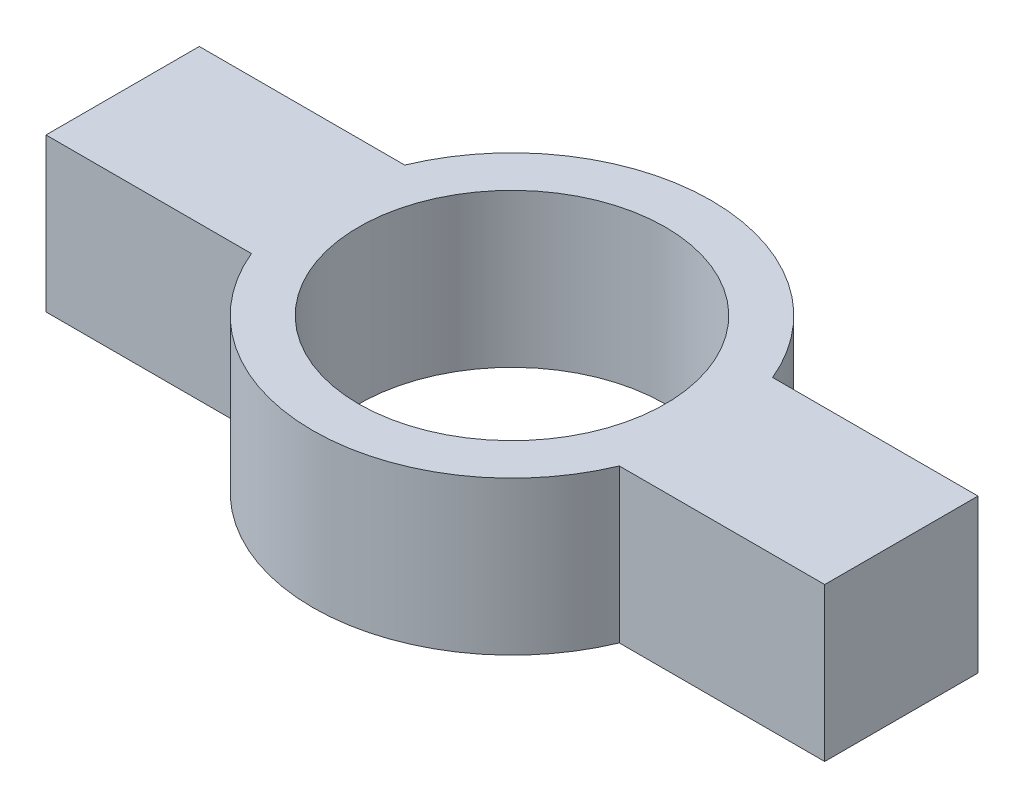
from build123d import *

# Parameters (mm, degrees)
SKETCH1_R           = 6.5
SKETCH1_R_2         = 5
BOSS_EXTRUDE1_DEPTH = 5
SKETCH2_W           = 5
SKETCH2_H           = 5
BOSS_EXTRUDE2_DEPTH = 12.7
SKETCH3_R           = 5
CUT_EXTRUDE1_DEPTH  = 16.117539482


with BuildPart() as part:
    # Sketch1 → Boss-Extrude1 (new body)
    with BuildSketch(Plane(origin=(0, 0, 0), x_dir=(1, 0, 0), z_dir=(0, 1, 0))):
        Circle(SKETCH1_R)
        Circle(SKETCH1_R_2, mode=Mode.SUBTRACT)
    extrude(amount=BOSS_EXTRUDE1_DEPTH)

    # Sketch2 → Boss-Extrude2 (add, symmetric)
    with BuildSketch(Plane(origin=(0, 0, 0), x_dir=(0, -1, 0), z_dir=(-1, 0, 0))):
        with Locations((-2.5, 0)):
            Rectangle(SKETCH2_W, SKETCH2_H)
    extrude(amount=BOSS_EXTRUDE2_DEPTH, both=True)

    # Sketch3 → Cut-Extrude1 (cut, through all)
    with BuildSketch(Plane(origin=(0, 5, 0), x_dir=(1, 0, 0), z_dir=(0, 1, 0))):
        Circle(SKETCH3_R)
    extrude(amount=-CUT_EXTRUDE1_DEPTH, mode=Mode.SUBTRACT)


solid = part.part
